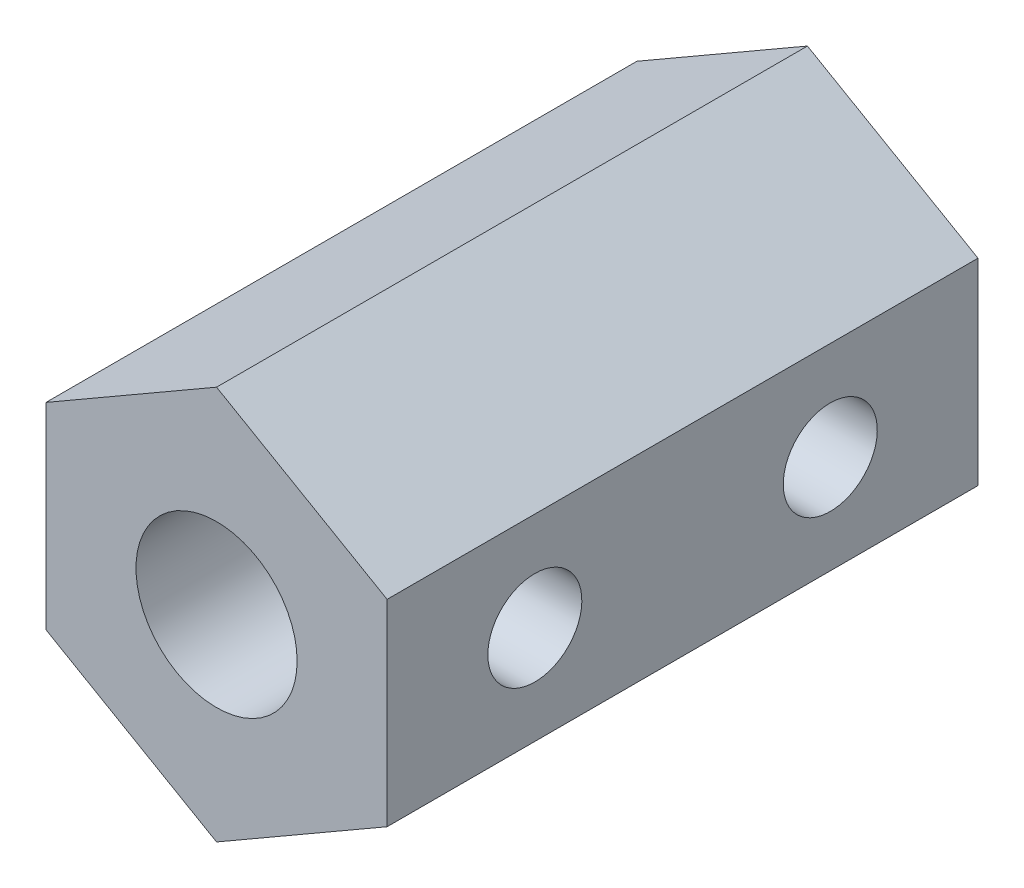
from build123d import *

# Parameters (mm, degrees)
ESQUISSE1_R             = 3
BOSS_EXTRU_1_DEPTH      = 22
ESQUISSE3_R             = 1.75
ENL_V_MAT_EXTRU_1_DEPTH = 4.5


with BuildPart() as part:
    # Esquisse1 → Boss.-Extru.1 (new body)
    with BuildSketch(Plane.XY):
        Polygon((0, 7.332348419), (-6.35, 3.666174209), (-6.35, -3.666174209), (0, -7.332348419), (6.35, -3.666174209), (6.35, 3.666174209), align=None)
        Circle(ESQUISSE1_R, mode=Mode.SUBTRACT)
    extrude(amount=BOSS_EXTRU_1_DEPTH)

    # Esquisse3 → Enlèv. mat.-Extru.1 (cut)
    with BuildSketch(Plane(origin=(6.35, 0, 0), x_dir=(0, 0, -1), z_dir=(1, 0, 0))):
        with Locations(Location((-5.5, 0, 0), (0, 0, 90))):
            Circle(ESQUISSE3_R)
        with Locations(Location((-16.5, 0, 0), (0, 0, 90))):
            Circle(ESQUISSE3_R)
    extrude(amount=-ENL_V_MAT_EXTRU_1_DEPTH, mode=Mode.SUBTRACT)


solid = part.part
